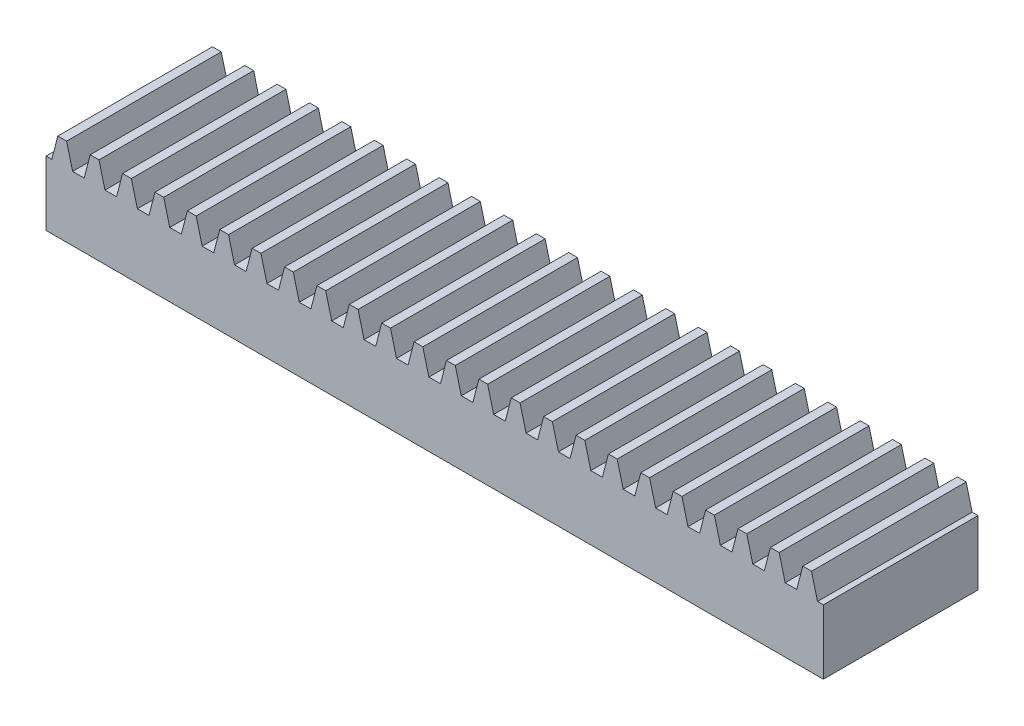
from build123d import *

# Parameters (mm, degrees)
BLANKSKE_W        = 150.8
BLANKSKE_H        = 17
BLANK_DEPTH       = 30
TOOTHCUTSIM_DEPTH = 155.692081245
TEETHCUTS_COUNT   = 25
TEETHCUTS_PITCH   = 6.2831853


with BuildPart() as part:
    # BlankSke → Blank (new body)
    with BuildSketch(Plane.XY):
        with Locations((75.4, 8.5)):
            Rectangle(BLANKSKE_W, BLANKSKE_H)
    extrude(amount=-BLANK_DEPTH)

    # TooCutSkeSim → ToothCutSim (cut, through all)
    with BuildSketch(Plane.XY):
        Polygon((1.125252364, 12.5), (-1.125252364, 12.5), (-2.29560038, 17.0254), (2.29560038, 17.0254), align=None)
    toothcutsim = extrude(amount=-TOOTHCUTSIM_DEPTH, mode=Mode.SUBTRACT)

    # TeethCuts: ToothCutSim ×25
    with Locations(*[(i * TEETHCUTS_PITCH, 0, 0) for i in range(1, TEETHCUTS_COUNT)]):
        add(toothcutsim, mode=Mode.SUBTRACT)


solid = part.part
